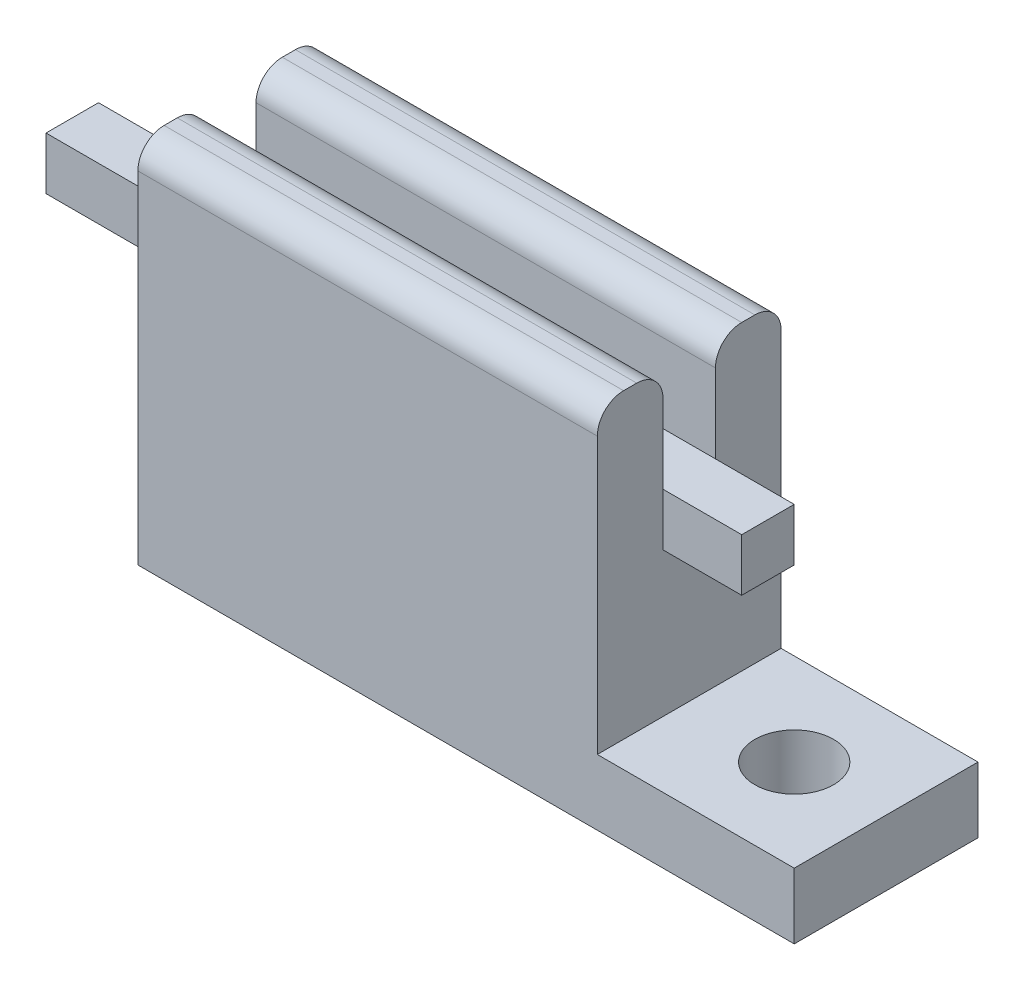
from build123d import *

# Parameters (mm, degrees)
SKETCH_1_W      = 50
SKETCH_1_H      = 14
SKETCH_1_R      = 3
EXTRUDE_1_DEPTH = 5
SKETCH_2_W      = 35
SKETCH_2_H      = 14
EXTRUDE_2_DEPTH = 15
SKETCH_3_W      = 35
SKETCH_3_H      = 5
EXTRUDE_3_DEPTH = 8
SKETCH_4_W      = 12
SKETCH_4_H      = 4
SKETCH_4_W_2    = 6
EXTRUDE_4_DEPTH = 4
FILLET_1_R      = 2


with BuildPart() as part:
    # Эскиз1 → Бобышка-Вытянуть1 (new body)
    with BuildSketch(Plane(origin=(0, 0, 0), x_dir=(1, 0, 0), z_dir=(0, 1, 0))):
        with Locations((-18, 0)):
            Rectangle(SKETCH_1_W, SKETCH_1_H)
        with Locations(Location((0, 0, 0), (0, 0, 270))):
            Circle(SKETCH_1_R, mode=Mode.SUBTRACT)
    extrude(amount=EXTRUDE_1_DEPTH)

    # Эскиз2 → Бобышка-Вытянуть2 (add)
    with BuildSketch(Plane(origin=(0, 5, 0), x_dir=(1, 0, 0), z_dir=(0, 1, 0))):
        with Locations((-25.5, 0)):
            Rectangle(SKETCH_2_W, SKETCH_2_H)
    extrude(amount=EXTRUDE_2_DEPTH)

    # Эскиз3 → Бобышка-Вытянуть3 (add)
    with BuildSketch(Plane(origin=(0, 20, 0), x_dir=(1, 0, 0), z_dir=(0, 1, 0))):
        with Locations((-25.5, -4.5)):
            Rectangle(SKETCH_3_W, SKETCH_3_H)
        with Locations((-25.5, 4.5)):
            Rectangle(SKETCH_3_W, SKETCH_3_H)
    extrude(amount=EXTRUDE_3_DEPTH)

    # Эскиз4 → Бобышка-Вытянуть4 (add)
    with BuildSketch(Plane(origin=(0, 20, 0), x_dir=(1, 0, 0), z_dir=(0, 1, 0))):
        with Locations((-49, 0)):
            Rectangle(SKETCH_4_W, SKETCH_4_H)
        with Locations((-5, 0)):
            Rectangle(SKETCH_4_W_2, SKETCH_4_H)
    extrude(amount=-EXTRUDE_4_DEPTH)

    # Скругление1
    fillet_1_edges = [part.edges().sort_by_distance(p)[0] for p in [
        (-25.5, 28, 7),
        (-25.5, 28, 2),
        (-25.5, 28, -7),
        (-25.5, 28, -2),
    ]]
    fillet(fillet_1_edges, radius=FILLET_1_R)


solid = part.part
